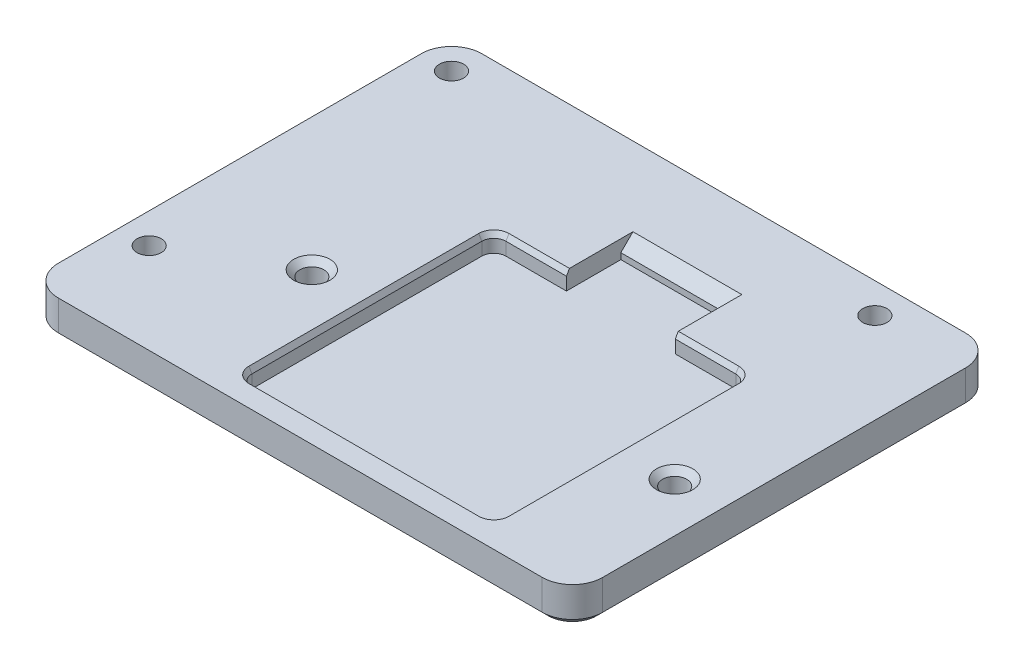
from build123d import *

# Parameters (mm, degrees)
SKETCH_1_W          = 90
SKETCH_1_H          = 70
SKETCH_1_R          = 2
EXTRUDE_1_DEPTH     = 6
FILLET_1_R          = 5
SKETCH_2_W          = 42
SKETCH_2_H          = 42
CUT_EXTRUDE_1_DEPTH = 3
FILLET_2_R          = 2
SKETCH_5_W          = 18
SKETCH_5_H          = 18
CUT_EXTRUDE_2_DEPTH = 3
CHAMFER_1_SIZE      = 2
CHAMFER_2_SIZE      = 1
SKETCH_6_R          = 2
CUT_EXTRUDE_3_DEPTH = 5
CHAMFER_3_SIZE      = 1
CHAMFER_4_SIZE      = 0.5
CHAMFER_4_SIZE2     = 0.866025404


with BuildPart() as part:
    # Эскиз1 → Бобышка-Вытянуть1 (new body)
    # profile 1 of 2: a face of its own
    with BuildSketch(Plane(origin=(0, 0, 0), x_dir=(1, 0, 0), z_dir=(0, 1, 0))):
        with Locations((5, -5)):
            Rectangle(SKETCH_1_W, SKETCH_1_H)
        with Locations((35, -25)):
            Circle(SKETCH_1_R, mode=Mode.SUBTRACT)
        with Locations(Location((-35, -25, 0), (0, 0, 270))):
            Circle(SKETCH_1_R, mode=Mode.SUBTRACT)
        with Locations(Location((35, 25, 0), (0, 0, 270))):
            Circle(SKETCH_1_R, mode=Mode.SUBTRACT)
        with Locations(Location((-35, 25, 0), (0, 0, 270))):
            Circle(SKETCH_1_R, mode=Mode.SUBTRACT)
    # profile 2 of 2: a face of its own
    with BuildSketch(Plane(origin=(0, 0, 0), x_dir=(1, 0, 0), z_dir=(0, 1, 0))):
        with Locations((35, -25)):
            Circle(SKETCH_1_R)
    extrude(amount=EXTRUDE_1_DEPTH)

    # Скругление1
    fillet_1_edges = [part.edges().sort_by_distance(p)[0] for p in [
        (-40, 3, 40),
        (-40, 3, -30),
        (50, 3, -30),
        (50, 3, 40),
    ]]
    fillet(fillet_1_edges, radius=FILLET_1_R)

    # Эскиз2 → Вырез-Вытянуть1 (cut)
    with BuildSketch(Plane(origin=(0, 6, 0), x_dir=(1, 0, 0), z_dir=(0, 1, 0))):
        with Locations((12, -15)):
            Rectangle(SKETCH_2_W, SKETCH_2_H)
    extrude(amount=-CUT_EXTRUDE_1_DEPTH, mode=Mode.SUBTRACT)

    # Скругление2
    fillet_2_edges = [part.edges().sort_by_distance(p)[0] for p in [
        (33, 4.5, -6),
        (33, 4.5, 36),
        (-9, 4.5, 36),
        (-9, 4.5, -6),
    ]]
    fillet(fillet_2_edges, radius=FILLET_2_R)

    # Эскиз5 → Вырез-Вытянуть2 (cut)
    with BuildSketch(Plane(origin=(0, 6, 0), x_dir=(1, 0, 0), z_dir=(0, 1, 0))):
        with Locations((12, 6)):
            Rectangle(SKETCH_5_W, SKETCH_5_H)
    extrude(amount=-CUT_EXTRUDE_2_DEPTH, mode=Mode.SUBTRACT)

    # Фаска1
    chamfer_1_edges = [part.edges().sort_by_distance(p)[0] for p in [
        (12, 6, -15),
    ]]
    chamfer(chamfer_1_edges, length=CHAMFER_1_SIZE)

    # Фаска2
    chamfer_2_edges = [part.edges().sort_by_distance(p)[0] for p in [
        (-35, 0, -27),
        (35, 0, -27),
        (-35, 0, 23),
        (-40, 0, 5),
        (5, 0, 40),
        (5, 0, -30),
        (50, 0, 5),
        (-38.535533906, 0, 38.535533906),
        (48.535533906, 0, 38.535533906),
        (48.535533906, 0, -28.535533906),
        (-38.535533906, 0, -28.535533906),
    ]]
    chamfer(chamfer_2_edges, length=CHAMFER_2_SIZE)

    # Эскиз6 → Вырез-Вытянуть3 (cut)
    with BuildSketch(Plane(origin=(0, 6, 0), x_dir=(1, 0, 0), z_dir=(0, 1, 0))):
        with Locations(Location((41.9, -15, 0), (0, 0, 270))):
            Circle(SKETCH_6_R)
        with Locations(Location((-18.1, -15, 0), (0, 0, 90))):
            Circle(SKETCH_6_R)
    extrude(amount=-CUT_EXTRUDE_3_DEPTH, mode=Mode.SUBTRACT)

    # Фаска3
    chamfer_3_edges = [part.edges().sort_by_distance(p)[0] for p in [
        (41.9, 6, 13),
        (-18.1, 6, 17),
    ]]
    chamfer(chamfer_3_edges, length=CHAMFER_3_SIZE)

    # Фаска4
    chamfer_4_edges = [part.edges().sort_by_distance(p)[0] for p in [
        (33, 6, 15),
        (12, 6, 36),
        (-9, 6, 15),
        (26, 6, -6),
        (32.414213562, 6, 35.414213562),
        (-8.414213562, 6, 35.414213562),
        (-8.414213562, 6, -5.414213562),
        (32.414213562, 6, -5.414213562),
        (-2, 6, -6),
    ]]
    chamfer_4_side = [part.faces().sort_by_distance(p)[0] for p in [
        (41.9, 6, 10.859824575),
    ]]
    chamfer(chamfer_4_edges, length=CHAMFER_4_SIZE, length2=CHAMFER_4_SIZE2, reference=chamfer_4_side[0])


solid = part.part
